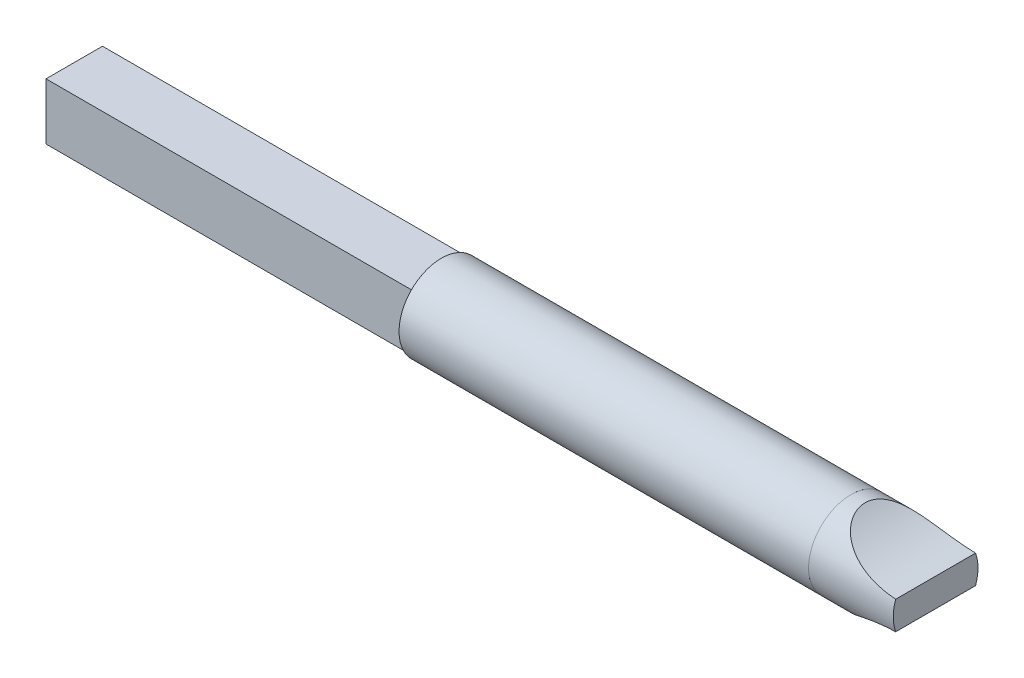
from build123d import *

# Parameters (mm, degrees)
SKETCH3_R           = 3
BOSS_EXTRUDE1_DEPTH = 29
SKETCH14_R          = 3
BOSS_EXTRUDE2_DEPTH = 6
CUT_EXTRUDE1_DEPTH  = 66.138314378
SKETCH16_W          = 4
SKETCH16_H          = 4
BOSS_EXTRUDE3_DEPTH = 30
SKETCH19_W          = 4
SKETCH19_H          = 4
CUT_EXTRUDE2_DEPTH  = 4


with BuildPart() as part:
    # Sketch1 → Loft1 section 0
    with BuildSketch(Plane(origin=(0, 0, 0), x_dir=(0, 0, -1), z_dir=(1, 0, 0))):
        with BuildLine():
            Line((-1, -1), (1, -1))
            Line((1, -1), (1, 1))
            Line((1, 1), (-1, 1))
            Line((-1, 1), (-1, -1))
        make_face()
    # Sketch2 → Loft1 section 1
    with BuildSketch(Plane(origin=(30, 0, 0), x_dir=(0, 0, -1), z_dir=(1, 0, 0))):
        with BuildLine():
            Line((-1, -1), (1, -1))
            Line((1, -1), (1, 1))
            Line((1, 1), (-1, 1))
            Line((-1, 1), (-1, -1))
        make_face()
    loft()

    # Sketch3 → Boss-Extrude1 (add)
    with BuildSketch(Plane(origin=(30, 0, 0), x_dir=(0, 0, -1), z_dir=(1, 0, 0))):
        with Locations(Location((0, 0, 0), (0, 0, 180))):
            Circle(SKETCH3_R)
    extrude(amount=BOSS_EXTRUDE1_DEPTH)

    # Sketch16 → Boss-Extrude3 (add)
    with BuildSketch(Plane.ZY):
        Rectangle(SKETCH16_W, SKETCH16_H)
    extrude(amount=-BOSS_EXTRUDE3_DEPTH)

    # Sketch19 → Cut-Extrude2 (cut)
    with BuildSketch(Plane.ZY):
        Rectangle(SKETCH19_W, SKETCH19_H)
    extrude(amount=-CUT_EXTRUDE2_DEPTH, mode=Mode.SUBTRACT)


with BuildPart() as body_2:
    # Sketch14 → Boss-Extrude2 (new body)
    with BuildSketch(Plane(origin=(59, 0, 0), x_dir=(0, 0, -1), z_dir=(1, 0, 0))):
        Circle(SKETCH14_R)
    extrude(amount=BOSS_EXTRUDE2_DEPTH)

    # Sketch15 → Cut-Extrude1 (cut, symmetric)
    with BuildSketch(Plane.XY):
        with BuildLine():
            Line((-45.087249476, 95.874046313), (60, 3))
            ThreePointArc((60, 3), (62.326656962, 1.566642406), (65, 1))
            Line((65, 1), (205.148729836, -4.220345412))
            Line((205.148729836, -4.220345412), (309.320785076, 256.209792687))
            Line((309.320785076, 256.209792687), (59.084805764, 356.304184412))
            Line((59.084805764, 356.304184412), (-45.087249476, 95.874046313))
        make_face()
    cut_extrude1 = extrude(amount=CUT_EXTRUDE1_DEPTH, both=True, mode=Mode.SUBTRACT)

    # Mirror1: Cut-Extrude1 across plane
    add(cut_extrude1.mirror(Plane.ZX), mode=Mode.SUBTRACT)


solid = Compound([part.part, body_2.part])
